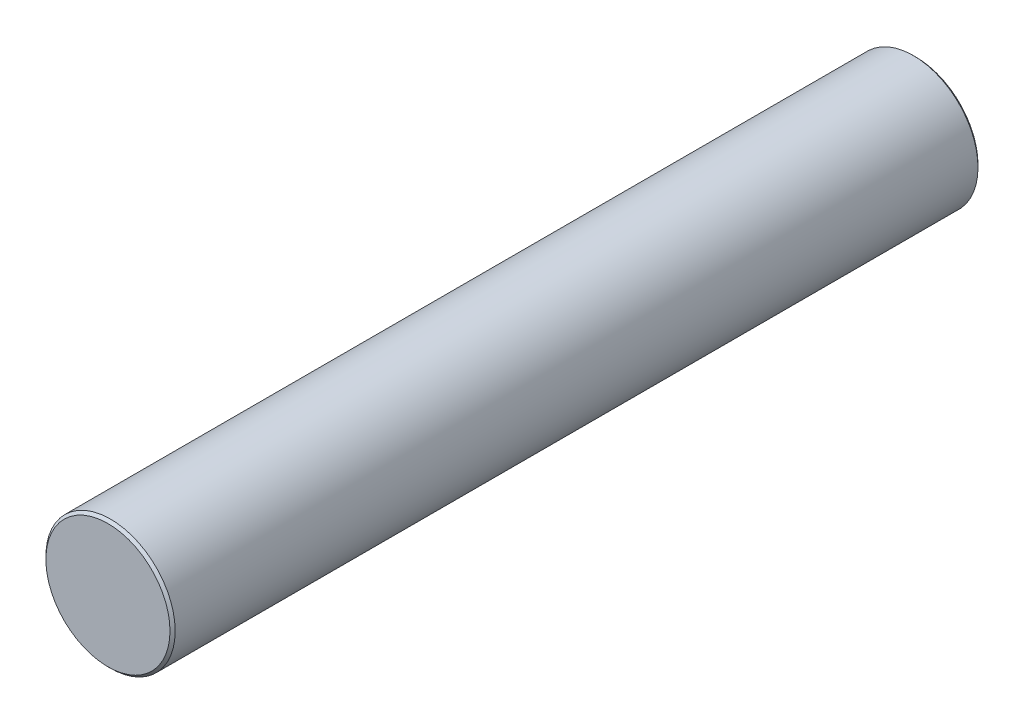
from build123d import *

# Parameters (mm, degrees)
BOSS_EXTRUDE1_DEPTH      = 25
BOSS_EXTRUDE1_DEPTH_BACK = 25
SKETCH2_R                = 4
CHAMFER1_SIZE            = 0.16


with BuildPart() as part:
    # Sketch2 → Boss-Extrude1 (new, two sides: drawn at the far end of the back side and taken through both)
    with BuildSketch(Plane.XY.offset(-BOSS_EXTRUDE1_DEPTH_BACK)):
        Circle(SKETCH2_R)
    extrude(amount=BOSS_EXTRUDE1_DEPTH + BOSS_EXTRUDE1_DEPTH_BACK)

    # Chamfer1
    chamfer1_edges = [part.edges().sort_by_distance(p)[0] for p in [
        (-4, 0, -25),
        (-4, 0, 25),
    ]]
    chamfer(chamfer1_edges, length=CHAMFER1_SIZE)


solid = part.part
